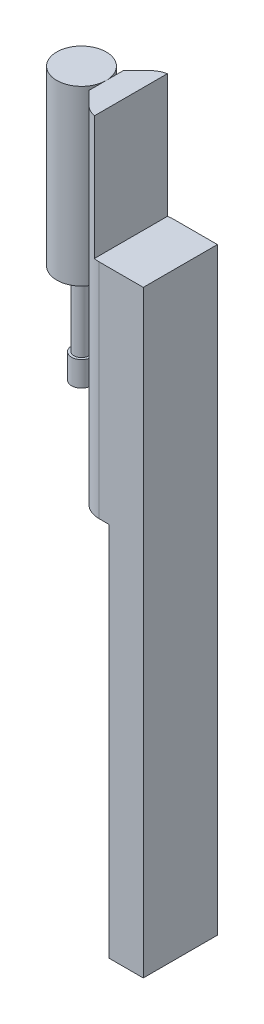
from build123d import *

# Parameters (mm, degrees)
SKETCH1_W           = 30
SKETCH1_H           = 30
BOSS_EXTRUDE1_DEPTH = 90
SKETCH2_W           = 30
SKETCH2_H           = 50
BOSS_EXTRUDE2_DEPTH = 10
SKETCH3_R           = 10
BOSS_EXTRUDE3_DEPTH = 70
SKETCH4_R           = 3
BOSS_EXTRUDE4_DEPTH = 30
SKETCH5_R           = 4
BOSS_EXTRUDE5_DEPTH = 10
CHAMFER1_SIZE       = 8
FILLET1_R           = 10
SKETCH6_W           = 13.80987909
SKETCH6_H           = 30
BOSS_EXTRUDE6_DEPTH = 152


with BuildPart() as part:
    # Sketch1 → Boss-Extrude1 (new body)
    with BuildSketch(Plane(origin=(0, 0, 0), x_dir=(1, 0, 0), z_dir=(0, 1, 0))):
        with Locations((15, 15)):
            Rectangle(SKETCH1_W, SKETCH1_H)
    extrude(amount=BOSS_EXTRUDE1_DEPTH)

    # Sketch2 → Boss-Extrude2 (add)
    with BuildSketch(Plane(origin=(0, 0, 0), x_dir=(0, 0, -1), z_dir=(1, 0, 0))):
        with Locations((15, 115)):
            Rectangle(SKETCH2_W, SKETCH2_H)
    extrude(amount=BOSS_EXTRUDE2_DEPTH)

    # Chamfer1
    chamfer1_edges = [part.edges().sort_by_distance(p)[0] for p in [
        (0, 70, -30),
        (0, 70, 0),
    ]]
    chamfer(chamfer1_edges, length=CHAMFER1_SIZE)

    # Fillet1
    fillet1_edges = [part.edges().sort_by_distance(p)[0] for p in [
        (8, 70, -30),
        (8, 70, 0),
    ]]
    fillet(fillet1_edges, radius=FILLET1_R)

    # Sketch6 → Boss-Extrude6 (add)
    with BuildSketch(Plane.XZ):
        with Locations((23.095060455, -15)):
            Rectangle(SKETCH6_W, SKETCH6_H)
    extrude(amount=BOSS_EXTRUDE6_DEPTH)


with BuildPart() as body_2:
    # Sketch3 → Boss-Extrude3 (new body)
    with BuildSketch(Plane(origin=(0, 140, 0), x_dir=(1, 0, 0), z_dir=(0, 1, 0))):
        with Locations(Location((-10, 15, 0), (0, 0, 270))):
            Circle(SKETCH3_R)
    extrude(amount=-BOSS_EXTRUDE3_DEPTH)

    # Sketch4 → Boss-Extrude4 (add)
    with BuildSketch(Plane.XZ.offset(-70)):
        with Locations(Location((-10, -15, 0), (0, 0, 270))):
            Circle(SKETCH4_R)
    extrude(amount=BOSS_EXTRUDE4_DEPTH)

    # Sketch5 → Boss-Extrude5 (add)
    with BuildSketch(Plane.XZ.offset(-40)):
        with Locations(Location((-10, -15, 0), (0, 0, 270))):
            Circle(SKETCH5_R)
    extrude(amount=BOSS_EXTRUDE5_DEPTH)


solid = Compound([part.part, body_2.part])
